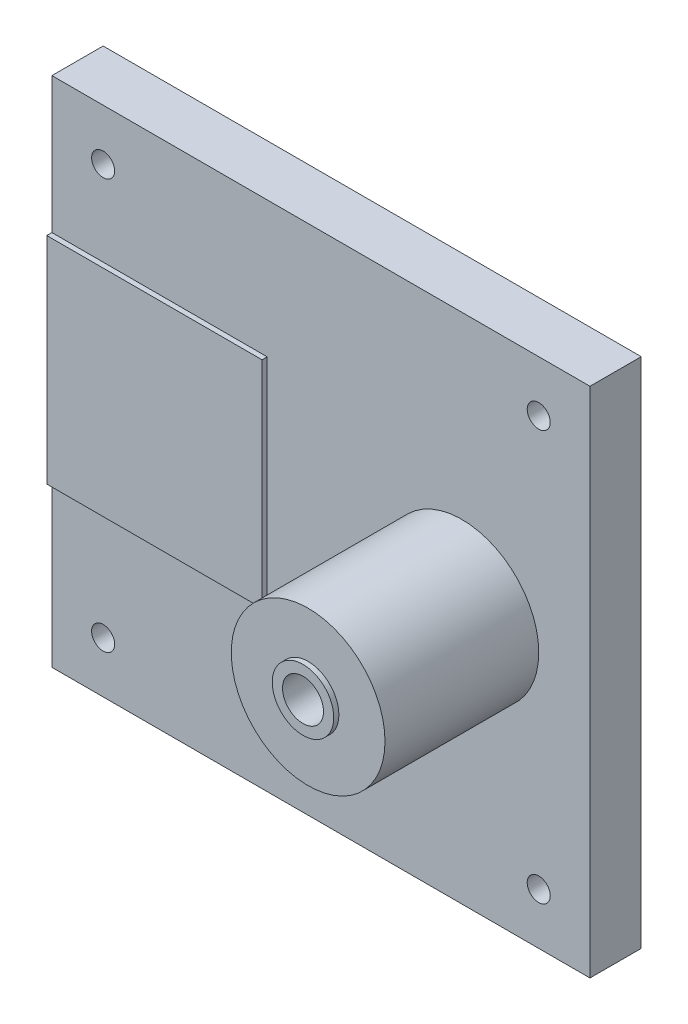
from build123d import *

# Parameters (mm, degrees)
SKETCH1_W           = 105
SKETCH1_H           = 100
BOSS_EXTRUDE1_DEPTH = 10
SKETCH4_R           = 15
BOSS_EXTRUDE2_DEPTH = 30
SKETCH5_R           = 4
CUT_EXTRUDE3_DEPTH  = 30
SKETCH6_W           = 42
SKETCH6_H           = 42
BOSS_EXTRUDE3_DEPTH = 1
SKETCH2_R           = 2.25
CUT_EXTRUDE4_DEPTH  = 99.994949366
BOSS_EXTRUDE4_START = 1
LOCAL_FILES1_R      = 6
LOCAL_FILES1_R_2    = 4
BOSS_EXTRUDE4_DEPTH = 1


with BuildPart() as part:
    # Sketch1 → Boss-Extrude1 (new body)
    with BuildSketch(Plane.XY):
        with Locations((-27.5, 0)):
            Rectangle(SKETCH1_W, SKETCH1_H)
    extrude(amount=BOSS_EXTRUDE1_DEPTH)

    # Sketch4 → Boss-Extrude2 (add)
    with BuildSketch(Plane.XY.offset(10)):
        Circle(SKETCH4_R)
    extrude(amount=BOSS_EXTRUDE2_DEPTH)

    # Sketch5 → Cut-Extrude3 (cut)
    with BuildSketch(Plane.XY.offset(40)):
        Circle(SKETCH5_R)
    extrude(amount=-CUT_EXTRUDE3_DEPTH, mode=Mode.SUBTRACT)

    # Sketch6 → Boss-Extrude3 (add)
    with BuildSketch(Plane.XY.offset(10)):
        with Locations((-59, 2.474517647)):
            Rectangle(SKETCH6_W, SKETCH6_H)
    extrude(amount=BOSS_EXTRUDE3_DEPTH)

    # Sketch2 → Cut-Extrude4 (cut, through all)
    with BuildSketch(Plane.XY.offset(10)):
        with Locations((-70, 40)):
            Circle(SKETCH2_R)
        with Locations((15, -40)):
            Circle(SKETCH2_R)
        with Locations(Location((-70, -40, 0), (0, 0, 180))):
            Circle(SKETCH2_R)
        with Locations(Location((15, 40, 0), (0, 0, 180))):
            Circle(SKETCH2_R)
    extrude(amount=-CUT_EXTRUDE4_DEPTH, mode=Mode.SUBTRACT)

    # Local Files1 → Boss-Extrude4 (add)
    with BuildSketch(Plane.XY.offset(40).offset(BOSS_EXTRUDE4_START)):
        Circle(LOCAL_FILES1_R)
        Circle(LOCAL_FILES1_R_2, mode=Mode.SUBTRACT)
    extrude(amount=-BOSS_EXTRUDE4_DEPTH)


solid = part.part
